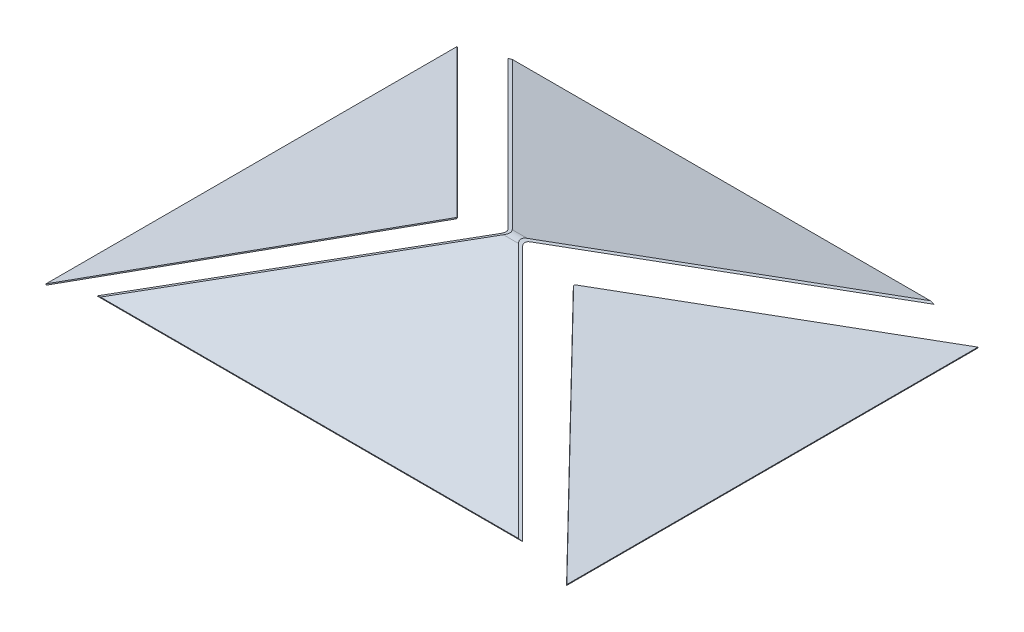
from build123d import *

# Parameters (mm, degrees)
EXTRUSION7_DEPTH      = 400
EXTRUSION8_DEPTH      = 448.325459802
EXTRUSION8_DEPTH_BACK = 448.325459802
EXTRUSION9_DEPTH      = 1
EXTRUSION10_DEPTH     = 1


with BuildPart() as part:
    # Sketch1 → Extrusion7 (new body)
    with BuildSketch(Plane.YZ):
        with BuildLine():
            Line((-51.763809021, 193.185165258), (-1.040255312, 3.882285677))
            ThreePointArc((-1.040255312, 3.882285677), (-0.529142706, 0), (-1.040255312, -3.882285677))
            Line((-1.040255312, -3.882285677), (-51.763809021, -193.185165258))
            Line((-51.763809021, -193.185165258), (-50.797883194, -193.443984303))
            Line((-50.797883194, -193.443984303), (-0.074329486, -4.141104722))
            ThreePointArc((-0.074329486, -4.141104722), (0.470857294, 0), (-0.074329486, 4.141104722))
            Line((-0.074329486, 4.141104722), (-50.797883194, 193.443984303))
            Line((-50.797883194, 193.443984303), (-51.763809021, 193.185165258))
        make_face()
    extrude(amount=EXTRUSION7_DEPTH)

    # Sketch2 → Extrusion8 (cut, two sides: drawn at the far end of the back side and taken through both)
    with BuildSketch(Plane.XY.offset(-EXTRUSION8_DEPTH_BACK)):
        with BuildLine():
            Line((0, -51.763809021), (196.117714323, 0.785774154))
            ThreePointArc((196.117714323, 0.785774154), (200, 1.29688676), (203.882285677, 0.785774154))
            Line((203.882285677, 0.785774154), (400, -51.763809021))
            Line((400, -51.763809021), (400, 8.236190979))
            Line((400, 8.236190979), (0, 8.236190979))
            Line((0, 8.236190979), (0, -51.763809021))
        make_face()
    extrude(amount=EXTRUSION8_DEPTH + EXTRUSION8_DEPTH_BACK, mode=Mode.SUBTRACT)


with BuildPart() as body_2:
    # Sketch3 → Extrusion9 (new body)
    with BuildSketch(Plane(origin=(13.853966988, 51.703708686, 0), x_dir=(-0.9659258262890683, 0.2588190451025207, 0), z_dir=(0.2588190451025207, 0.9659258262890683, 0))):
        with BuildLine():
            Line((-445.772513214, 196.375609094), (-445.772513214, -189.994721421))
            Line((-445.772513214, -189.994721421), (-249.7917511, -0.69184184))
            add(Edge.make_bspline(
                [(-249.7917511, -0.69184184), (-249.743771624, 0), (-249.7917511, 0.69184184)],
                knots=[3.072353159, 3.072353159, 3.072353159, 3.210832148, 3.210832148, 3.210832148], degree=2, weights=[1, 0.997603904, 1]))
            Line((-249.7917511, 0.69184184), (-445.772513214, 196.375609094))
        make_face()
    extrude(amount=EXTRUSION9_DEPTH)


with BuildPart() as body_3:
    # Sketch4 → Extrusion10 (new body)
    with BuildSketch(Plane(origin=(12.940952255, -48.296291314, 0), x_dir=(-0.9659258262890683, -0.25881904510252063, 0), z_dir=(-0.25881904510252063, 0.9659258262890683, 0))):
        with BuildLine():
            Line((-136.578579415, -0.69184184), (59.402182698, -189.994721421))
            Line((59.402182698, -189.994721421), (59.402182698, 196.375609094))
            Line((59.402182698, 196.375609094), (-136.578579415, 0.69184184))
            add(Edge.make_bspline(
                [(-136.578579415, 0.69184184), (-136.626558892, 0), (-136.578579415, -0.69184184)],
                knots=[1.501556832, 1.501556832, 1.501556832, 1.640035821, 1.640035821, 1.640035821], degree=2, weights=[1, 0.997603904, 1]))
        make_face()
    extrude(amount=EXTRUSION10_DEPTH)


solid = Compound([part.part, body_2.part, body_3.part])
